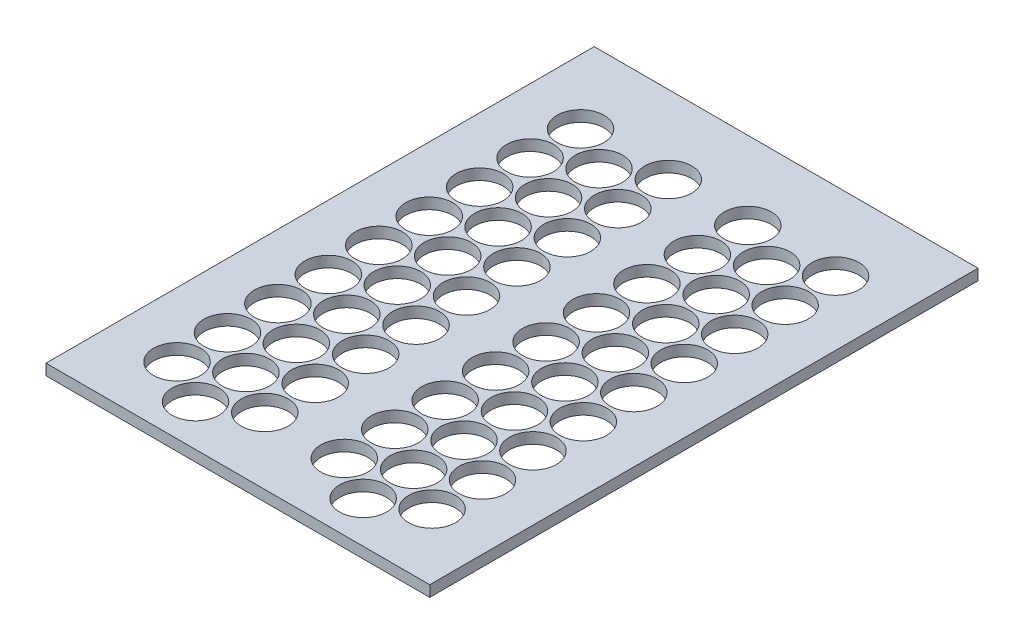
from build123d import *

# Parameters (mm, degrees)
SKETCH1_W           = 177.8
SKETCH1_H           = 254
SKETCH1_R           = 10.90200004
BOSS_EXTRUDE1_DEPTH = 5.08


with BuildPart() as part:
    # Sketch1 → Boss-Extrude1 (new body)
    with BuildSketch(Plane(origin=(0, 0, 0), x_dir=(1, 0, 0), z_dir=(0, 1, 0))):
        Rectangle(SKETCH1_W, SKETCH1_H)
        with Locations(Location((-59.07499996, 90.82499996, 0), (0, 0, 270))):
            Circle(SKETCH1_R, mode=Mode.SUBTRACT)
        with Locations(Location((-18.43499996, 90.82499996, 0), (0, 0, 270))):
            Circle(SKETCH1_R, mode=Mode.SUBTRACT)
        with Locations(Location((-18.43499996, 67.45699996, 0), (0, 0, 270))):
            Circle(SKETCH1_R, mode=Mode.SUBTRACT)
        with Locations(Location((-18.43499996, 44.08899996, 0), (0, 0, 270))):
            Circle(SKETCH1_R, mode=Mode.SUBTRACT)
        with Locations(Location((-18.43499996, 20.72099996, 0), (0, 0, 270))):
            Circle(SKETCH1_R, mode=Mode.SUBTRACT)
        with Locations(Location((-18.43499996, -2.64700004, 0), (0, 0, 270))):
            Circle(SKETCH1_R, mode=Mode.SUBTRACT)
        with Locations(Location((-18.43499996, -26.01500004, 0), (0, 0, 270))):
            Circle(SKETCH1_R, mode=Mode.SUBTRACT)
        with Locations(Location((-18.43499996, -49.38300004, 0), (0, 0, 270))):
            Circle(SKETCH1_R, mode=Mode.SUBTRACT)
        with Locations(Location((-18.43499996, -72.75100004, 0), (0, 0, 270))):
            Circle(SKETCH1_R, mode=Mode.SUBTRACT)
        with Locations(Location((-18.43499996, -96.11900004, 0), (0, 0, 270))):
            Circle(SKETCH1_R, mode=Mode.SUBTRACT)
        with Locations(Location((-59.07499996, 67.45699996, 0), (0, 0, 270))):
            Circle(SKETCH1_R, mode=Mode.SUBTRACT)
        with Locations(Location((-59.07499996, 44.08899996, 0), (0, 0, 270))):
            Circle(SKETCH1_R, mode=Mode.SUBTRACT)
        with Locations(Location((-59.07499996, 20.72099996, 0), (0, 0, 270))):
            Circle(SKETCH1_R, mode=Mode.SUBTRACT)
        with Locations(Location((-59.07499996, -2.64700004, 0), (0, 0, 270))):
            Circle(SKETCH1_R, mode=Mode.SUBTRACT)
        with Locations(Location((-59.07499996, -26.01500004, 0), (0, 0, 270))):
            Circle(SKETCH1_R, mode=Mode.SUBTRACT)
        with Locations(Location((-59.07499996, -49.38300004, 0), (0, 0, 270))):
            Circle(SKETCH1_R, mode=Mode.SUBTRACT)
        with Locations(Location((-59.07499996, -72.75100004, 0), (0, 0, 270))):
            Circle(SKETCH1_R, mode=Mode.SUBTRACT)
        with Locations(Location((-59.07499996, -96.11900004, 0), (0, 0, 270))):
            Circle(SKETCH1_R, mode=Mode.SUBTRACT)
        with Locations(Location((-38.837718324, -107.80300004, 0), (0, 0, 270))):
            Circle(SKETCH1_R, mode=Mode.SUBTRACT)
        with Locations(Location((-38.837718324, -84.43500004, 0), (0, 0, 270))):
            Circle(SKETCH1_R, mode=Mode.SUBTRACT)
        with Locations(Location((-38.837718324, -61.06700004, 0), (0, 0, 270))):
            Circle(SKETCH1_R, mode=Mode.SUBTRACT)
        with Locations(Location((-38.837718324, -37.69900004, 0), (0, 0, 270))):
            Circle(SKETCH1_R, mode=Mode.SUBTRACT)
        with Locations(Location((-38.837718324, -14.33100004, 0), (0, 0, 270))):
            Circle(SKETCH1_R, mode=Mode.SUBTRACT)
        with Locations(Location((-38.837718324, 9.03699996, 0), (0, 0, 270))):
            Circle(SKETCH1_R, mode=Mode.SUBTRACT)
        with Locations(Location((-38.837718324, 32.40499996, 0), (0, 0, 270))):
            Circle(SKETCH1_R, mode=Mode.SUBTRACT)
        with Locations(Location((-38.837718324, 55.77299996, 0), (0, 0, 270))):
            Circle(SKETCH1_R, mode=Mode.SUBTRACT)
        with Locations(Location((-38.837718324, 79.14099996, 0), (0, 0, 270))):
            Circle(SKETCH1_R, mode=Mode.SUBTRACT)
        with Locations(Location((59.07499996, -96.11900004, 0), (0, 0, 90))):
            Circle(SKETCH1_R, mode=Mode.SUBTRACT)
        with Locations(Location((18.43499996, -72.75100004, 0), (0, 0, 90))):
            Circle(SKETCH1_R, mode=Mode.SUBTRACT)
        with Locations(Location((18.43499996, -96.11900004, 0), (0, 0, 90))):
            Circle(SKETCH1_R, mode=Mode.SUBTRACT)
        with Locations(Location((38.837718324, -84.43500004, 0), (0, 0, 90))):
            Circle(SKETCH1_R, mode=Mode.SUBTRACT)
        with Locations(Location((38.837718324, -107.80300004, 0), (0, 0, 90))):
            Circle(SKETCH1_R, mode=Mode.SUBTRACT)
        with Locations(Location((59.07499996, -72.75100004, 0), (0, 0, 90))):
            Circle(SKETCH1_R, mode=Mode.SUBTRACT)
        with Locations(Location((59.07499996, -49.38300004, 0), (0, 0, 90))):
            Circle(SKETCH1_R, mode=Mode.SUBTRACT)
        with Locations(Location((38.837718324, -61.06700004, 0), (0, 0, 90))):
            Circle(SKETCH1_R, mode=Mode.SUBTRACT)
        with Locations(Location((18.43499996, -49.38300004, 0), (0, 0, 90))):
            Circle(SKETCH1_R, mode=Mode.SUBTRACT)
        with Locations(Location((38.837718324, -37.69900004, 0), (0, 0, 90))):
            Circle(SKETCH1_R, mode=Mode.SUBTRACT)
        with Locations(Location((59.07499996, -26.01500004, 0), (0, 0, 90))):
            Circle(SKETCH1_R, mode=Mode.SUBTRACT)
        with Locations(Location((18.43499996, -26.01500004, 0), (0, 0, 90))):
            Circle(SKETCH1_R, mode=Mode.SUBTRACT)
        with Locations(Location((38.837718324, -14.33100004, 0), (0, 0, 90))):
            Circle(SKETCH1_R, mode=Mode.SUBTRACT)
        with Locations(Location((59.07499996, -2.64700004, 0), (0, 0, 90))):
            Circle(SKETCH1_R, mode=Mode.SUBTRACT)
        with Locations(Location((18.43499996, -2.64700004, 0), (0, 0, 90))):
            Circle(SKETCH1_R, mode=Mode.SUBTRACT)
        with Locations(Location((38.837718324, 9.03699996, 0), (0, 0, 90))):
            Circle(SKETCH1_R, mode=Mode.SUBTRACT)
        with Locations(Location((59.07499996, 20.72099996, 0), (0, 0, 90))):
            Circle(SKETCH1_R, mode=Mode.SUBTRACT)
        with Locations(Location((18.43499996, 20.72099996, 0), (0, 0, 90))):
            Circle(SKETCH1_R, mode=Mode.SUBTRACT)
        with Locations(Location((38.837718324, 32.40499996, 0), (0, 0, 90))):
            Circle(SKETCH1_R, mode=Mode.SUBTRACT)
        with Locations(Location((59.07499996, 44.08899996, 0), (0, 0, 90))):
            Circle(SKETCH1_R, mode=Mode.SUBTRACT)
        with Locations(Location((18.43499996, 44.08899996, 0), (0, 0, 90))):
            Circle(SKETCH1_R, mode=Mode.SUBTRACT)
        with Locations(Location((18.43499996, 67.45699996, 0), (0, 0, 90))):
            Circle(SKETCH1_R, mode=Mode.SUBTRACT)
        with Locations(Location((38.837718324, 55.77299996, 0), (0, 0, 90))):
            Circle(SKETCH1_R, mode=Mode.SUBTRACT)
        with Locations(Location((59.07499996, 67.45699996, 0), (0, 0, 90))):
            Circle(SKETCH1_R, mode=Mode.SUBTRACT)
        with Locations(Location((38.837718324, 79.14099996, 0), (0, 0, 90))):
            Circle(SKETCH1_R, mode=Mode.SUBTRACT)
        with Locations(Location((18.43499996, 90.82499996, 0), (0, 0, 90))):
            Circle(SKETCH1_R, mode=Mode.SUBTRACT)
        with Locations(Location((59.07499996, 90.82499996, 0), (0, 0, 90))):
            Circle(SKETCH1_R, mode=Mode.SUBTRACT)
    extrude(amount=BOSS_EXTRUDE1_DEPTH)


solid = part.part
